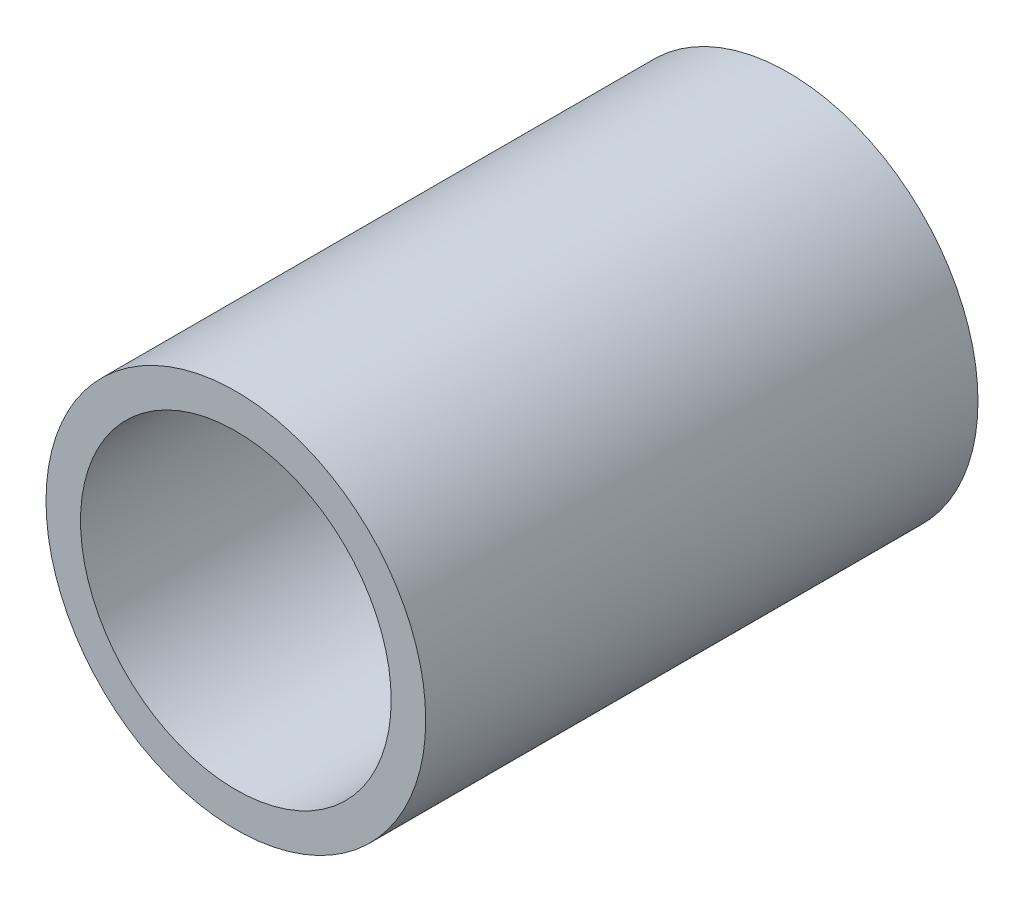
from build123d import *

# Parameters (mm, degrees)
BOSS_EXTRUDE1_DEPTH      = 160
BOSS_EXTRUDE1_DEPTH_BACK = 160
SKETCH2_R                = 110
SKETCH2_R_2              = 90


with BuildPart() as part:
    # Sketch2 → Boss-Extrude1 (new, two sides: drawn at the far end of the back side and taken through both)
    with BuildSketch(Plane.XY.offset(-BOSS_EXTRUDE1_DEPTH_BACK)):
        with Locations((2200, 0)):
            Circle(SKETCH2_R)
        with Locations((2200, 0)):
            Circle(SKETCH2_R_2, mode=Mode.SUBTRACT)
    extrude(amount=BOSS_EXTRUDE1_DEPTH + BOSS_EXTRUDE1_DEPTH_BACK)


solid = part.part
